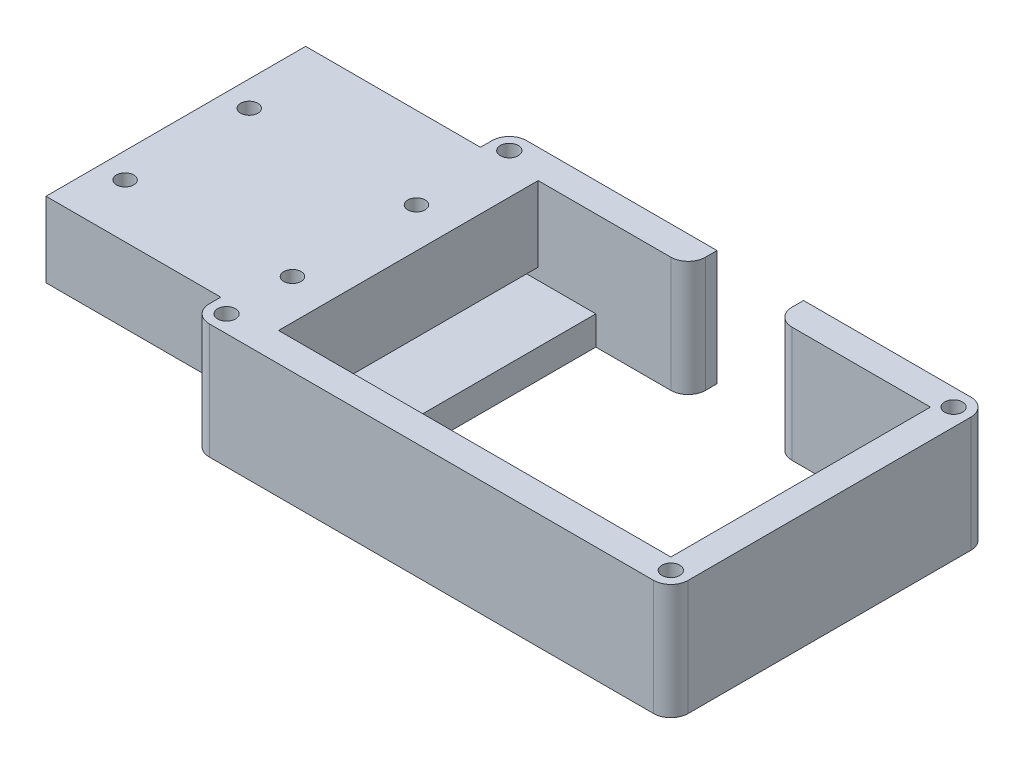
from build123d import *

# Parameters (mm, degrees)
EXTRUDE_1_DEPTH             = 10
EXTRUDE_2_REACH             = 34.619
SKETCH_2_R                  = 10
EXTRUDE_2_DIRECTION_2_DEPTH = 2
SKETCH_6_R                  = 1.65
SKETCH_6_W                  = 14.704506527
SKETCH_6_H                  = 8.520368268
CUT_EXTRUDE_2_DEPTH         = 43.983979574
FILLET_1_R                  = 1
FILLET_2_R                  = 0.5
EXTRUDE_3_DEPTH             = 8
EXTRUDE_4_DEPTH             = 55
SKETCH_9_W                  = 73
SKETCH_9_H                  = 45
CUT_EXTRUDE_3_DEPTH         = 13
SKETCH_10_W                 = 15
SKETCH_10_H                 = 20
CUT_EXTRUDE_4_DEPTH         = 13
SKETCH_11_W                 = 73
SKETCH_11_H                 = 45
CUT_EXTRUDE_6_DEPTH         = 13
SKETCH_12_W                 = 15
SKETCH_12_H                 = 45
SKETCH_12_W_2               = 10
EXTRUDE_5_DEPTH             = 5
FILLET_3_R                  = 3
SKETCH_14_R                 = 1.55
CUT_EXTRUDE_7_DEPTH         = 102.004950374
SKETCH_15_W                 = 8
SKETCH_15_H                 = 22
CUT_EXTRUDE_8_DEPTH         = 20
SKETCH_18_W                 = 5
SKETCH_18_H                 = 45
SKETCH_18_W_2               = 30.3
EXTRUDE_6_DEPTH             = 13
SKETCH_20_R                 = 1.5
CUT_EXTRUDE_9_DEPTH         = 13


with BuildPart() as part:
    # 草图1 → 凸台-拉伸1 (new, symmetric)
    with BuildSketch(Plane.XY):
        with BuildLine():
            Line((-1.15, 3.987480407), (-1.15, 12))
            Line((-1.15, 12), (-4.15, 12))
            Line((-4.15, 12), (-4.15, 4.333301282))
            ThreePointArc((-4.15, 4.333301282), (-4.784308974, 3.620826928), (-5.297685557, 2.816829377))
            Line((-5.297685557, 2.816829377), (-8, -2.265484914))
            Line((-8, -2.265484914), (-8, -30))
            Line((-8, -30), (0, -30))
            Line((0, -30), (0, -8.485281374))
            Line((0, -8.485281374), (4.242640687, -4.242640687))
            ThreePointArc((4.242640687, -4.242640687), (5.999649956, 0.064810571), (4.15, 4.333301282))
            Line((4.15, 4.333301282), (4.15, 12))
            Line((4.15, 12), (1.15, 12))
            Line((1.15, 12), (1.15, 3.987480407))
            ThreePointArc((1.15, 3.987480407), (0, -4.15), (-1.15, 3.987480407))
        make_face()
    extrude(amount=EXTRUDE_1_DEPTH, both=True)

    # 凸台-拉伸2: up to this face of the body (flat: up to its plane)
    extrude_2_end = Plane(part.part.faces().sort_by_distance((-8, -16.132742457, 0))[0])
    # 草图2 → 凸台-拉伸2 (add, up to the picked face)
    with BuildSketch(Plane(origin=(0, 0, 0), x_dir=(0, 0, -1), z_dir=(1, 0, 0)), mode=Mode.PRIVATE) as extrude_2_sk1:
        with Locations((0, -30)):
            Circle(SKETCH_2_R)
    extrude_2_tool1 = split(extrude(extrude_2_sk1.sketch, amount=-EXTRUDE_2_REACH, mode=Mode.PRIVATE), bisect_by=extrude_2_end, keep=Keep.BOTH, mode=Mode.PRIVATE)
    add(extrude_2_tool1.solids().sort_by(Axis((0, -30, 0), (-1, 0, 0)))[0])

    # 草图2 → 凸台-拉伸2 direction 2 (add)
    with BuildSketch(Plane(origin=(0, 0, 0), x_dir=(0, 0, -1), z_dir=(1, 0, 0))):
        with Locations((0, -30)):
            Circle(SKETCH_2_R)
    extrude(amount=EXTRUDE_2_DIRECTION_2_DEPTH)

    # 草图6 → 切除-拉伸2 (cut, through all)
    with BuildSketch(Plane(origin=(4.15, 0, 0), x_dir=(0, 0, -1), z_dir=(1, 0, 0))):
        with Locations(Location((0, 9.5, 0), (0, 0, 90))):
            Circle(SKETCH_6_R)
        with Locations((-12.852253263, 11.760184134)):
            Rectangle(SKETCH_6_W, SKETCH_6_H)
        with Locations((12.852253263, 11.760184134)):
            Rectangle(SKETCH_6_W, SKETCH_6_H)
    extrude(amount=-CUT_EXTRUDE_2_DEPTH, mode=Mode.SUBTRACT)

    # 圆角1
    fillet_1_edges = [part.edges().sort_by_distance(p)[0] for p in [
        (2.65, 7.5, -10),
        (-2.65, 7.5, -10),
        (2.65, 7.5, 10),
        (-2.65, 7.5, 10),
        (2.65, 12, 5.5),
        (-2.65, 12, 5.5),
        (2.65, 12, -5.5),
        (-2.65, 12, -5.5),
    ]]
    fillet(fillet_1_edges, radius=FILLET_1_R)

    # 圆角2
    fillet_2_edges = [part.edges().sort_by_distance(p)[0] for p in [
        (-2.65, 7.5, 5.5),
        (2.65, 7.5, 5.5),
        (2.65, 7.5, -5.5),
        (-2.65, 7.5, -5.5),
    ]]
    fillet(fillet_2_edges, radius=FILLET_2_R)

    # 草图7 → 凸台-拉伸3 (add)
    with BuildSketch(Plane(origin=(2, 0, 0), x_dir=(0, 0, -1), z_dir=(1, 0, 0))):
        with BuildLine():
            Line((0, -20), (-22, -20))
            Line((-22, -20), (-22, -40))
            Line((-22, -40), (0, -40))
            ThreePointArc((0, -40), (10, -30), (0, -20))
        make_face()
    extrude(amount=EXTRUDE_3_DEPTH)

    # 草图8 → 凸台-拉伸4 (add)
    with BuildSketch(Plane.XY.offset(22)):
        Polygon((10, -20), (-26, -20), (-26, -40), (2, -40), (57, -40), (57, -20), align=None)
    extrude(amount=EXTRUDE_4_DEPTH)

    # 草图9 → 切除-拉伸3 (cut)
    with BuildSketch(Plane(origin=(0, -20, 0), x_dir=(1, 0, 0), z_dir=(0, 1, 0))):
        with Locations((15.5, -49.5)):
            Rectangle(SKETCH_9_W, SKETCH_9_H)
    extrude(amount=-CUT_EXTRUDE_3_DEPTH, mode=Mode.SUBTRACT)

    # 草图10 → 切除-拉伸4 (cut)
    with BuildSketch(Plane(origin=(0, 0, 22), x_dir=(-1, 0, 0), z_dir=(0, 0, -1))):
        with Locations((-17.5, -30)):
            Rectangle(SKETCH_10_W, SKETCH_10_H)
    extrude(amount=-CUT_EXTRUDE_4_DEPTH, mode=Mode.SUBTRACT)

    # 草图11 → 切除-拉伸6 (cut)
    with BuildSketch(Plane(origin=(0, -33, 0), x_dir=(1, 0, 0), z_dir=(0, 1, 0))):
        with Locations((15.5, -49.5)):
            Rectangle(SKETCH_11_W, SKETCH_11_H)
    extrude(amount=-CUT_EXTRUDE_6_DEPTH, mode=Mode.SUBTRACT)

    # 草图12 → 凸台-拉伸5 (add)
    with BuildSketch(Plane.XZ.offset(40)):
        with Locations((-13.5, 49.5)):
            Rectangle(SKETCH_12_W, SKETCH_12_H)
        with Locations((47, 49.5)):
            Rectangle(SKETCH_12_W_2, SKETCH_12_H)
    extrude(amount=-EXTRUDE_5_DEPTH)

    # 圆角3
    fillet_3_edges = [part.edges().sort_by_distance(p)[0] for p in [
        (-26, -30, 22),
        (57, -30, 22),
        (-26, -30, 77),
        (57, -30, 77),
        (10, -30, 27),
        (25, -30, 27),
    ]]
    fillet(fillet_3_edges, radius=FILLET_3_R)

    # 草图14 → 切除-拉伸7 (cut, through all)
    with BuildSketch(Plane(origin=(0, -20, 0), x_dir=(1, 0, 0), z_dir=(0, 1, 0))):
        with Locations(Location((-23, -25, 0), (0, 0, 270))):
            Circle(SKETCH_14_R)
        with Locations(Location((54, -25, 0), (0, 0, 270))):
            Circle(SKETCH_14_R)
        with Locations(Location((-23, -74, 0), (0, 0, 270))):
            Circle(SKETCH_14_R)
        with Locations(Location((54, -74, 0), (0, 0, 270))):
            Circle(SKETCH_14_R)
    extrude(amount=-CUT_EXTRUDE_7_DEPTH, mode=Mode.SUBTRACT)

    # 草图15 → 切除-拉伸8 (cut)
    with BuildSketch(Plane(origin=(0, -20, 0), x_dir=(1, 0, 0), z_dir=(0, 1, 0))):
        with Locations((6, -11)):
            Rectangle(SKETCH_15_W, SKETCH_15_H)
    extrude(amount=-CUT_EXTRUDE_8_DEPTH, mode=Mode.SUBTRACT)


with BuildPart() as body_2:
    # of the pieces the cut leaves, the one that is kept (cut_extrude_8_keep)
    add(part.part.solids().sort_by_distance((-26, -20, 25))[0])

    # 草图18 → 凸台-拉伸6 (add)
    with BuildSketch(Plane(origin=(0, -20, 0), x_dir=(1, 0, 0), z_dir=(0, 1, 0))):
        with Locations((-18.5, -49.5)):
            Rectangle(SKETCH_18_W, SKETCH_18_H)
        with Locations((-41.15, -49.5)):
            Rectangle(SKETCH_18_W_2, SKETCH_18_H)
    extrude(amount=-EXTRUDE_6_DEPTH)

    # 草图20 → 切除-拉伸9 (cut)
    with BuildSketch(Plane(origin=(0, -20, 0), x_dir=(1, 0, 0), z_dir=(0, 1, 0))):
        with Locations(Location((-22.89532608, -62.69503523, 0), (0, 0, 270))):
            Circle(SKETCH_20_R)
        with Locations(Location((-51.895321909, -41.179481559, 0), (0, 0, 270))):
            Circle(SKETCH_20_R)
        with Locations((-21.949220364, 0)):
            Circle(SKETCH_20_R)
        with Locations(Location((-51.895321909, -62.69503523, 0), (0, 0, 270))):
            Circle(SKETCH_20_R)
        with Locations(Location((-22.89532608, -41.19503523, 0), (0, 0, 270))):
            Circle(SKETCH_20_R)
    extrude(amount=-CUT_EXTRUDE_9_DEPTH, mode=Mode.SUBTRACT)


solid = body_2.part
